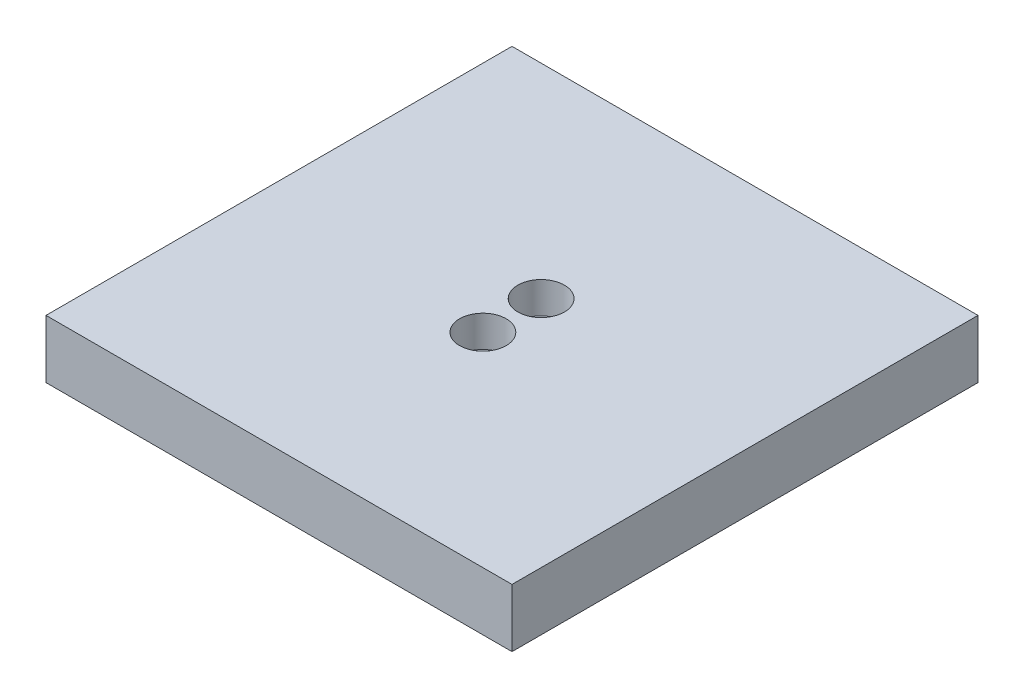
from build123d import *

# Parameters (mm, degrees)
SKETCH_1_W          = 40
SKETCH_1_H          = 40
EXTRUDE_1_DEPTH     = 5
SKETCH_2_R          = 1.2
CUT_EXTRUDE_1_DEPTH = 57.789083458
SKETCH_3_R          = 2
CUT_EXTRUDE_2_DEPTH = 2.7


with BuildPart() as part:
    # 草图1 → 凸台-拉伸1 (new body)
    with BuildSketch(Plane(origin=(0, 0, 0), x_dir=(1, 0, 0), z_dir=(0, 1, 0))):
        with Locations((20, -20)):
            Rectangle(SKETCH_1_W, SKETCH_1_H)
    extrude(amount=EXTRUDE_1_DEPTH)

    # 草图2 → 切除-拉伸1 (cut, through all)
    with BuildSketch(Plane(origin=(0, 5, 0), x_dir=(1, 0, 0), z_dir=(0, 1, 0))):
        with Locations(Location((20, -17.5, 0), (0, 0, 270))):
            Circle(SKETCH_2_R)
        with Locations(Location((20, -22.5, 0), (0, 0, 270))):
            Circle(SKETCH_2_R)
    extrude(amount=-CUT_EXTRUDE_1_DEPTH, mode=Mode.SUBTRACT)

    # 草图3 → 切除-拉伸2 (cut)
    with BuildSketch(Plane(origin=(0, 5, 0), x_dir=(1, 0, 0), z_dir=(0, 1, 0))):
        with Locations(Location((20, -17.5, 0), (0, 0, 270))):
            Circle(SKETCH_3_R)
        with Locations(Location((20, -22.5, 0), (0, 0, 270))):
            Circle(SKETCH_3_R)
    extrude(amount=-CUT_EXTRUDE_2_DEPTH, mode=Mode.SUBTRACT)


solid = part.part
